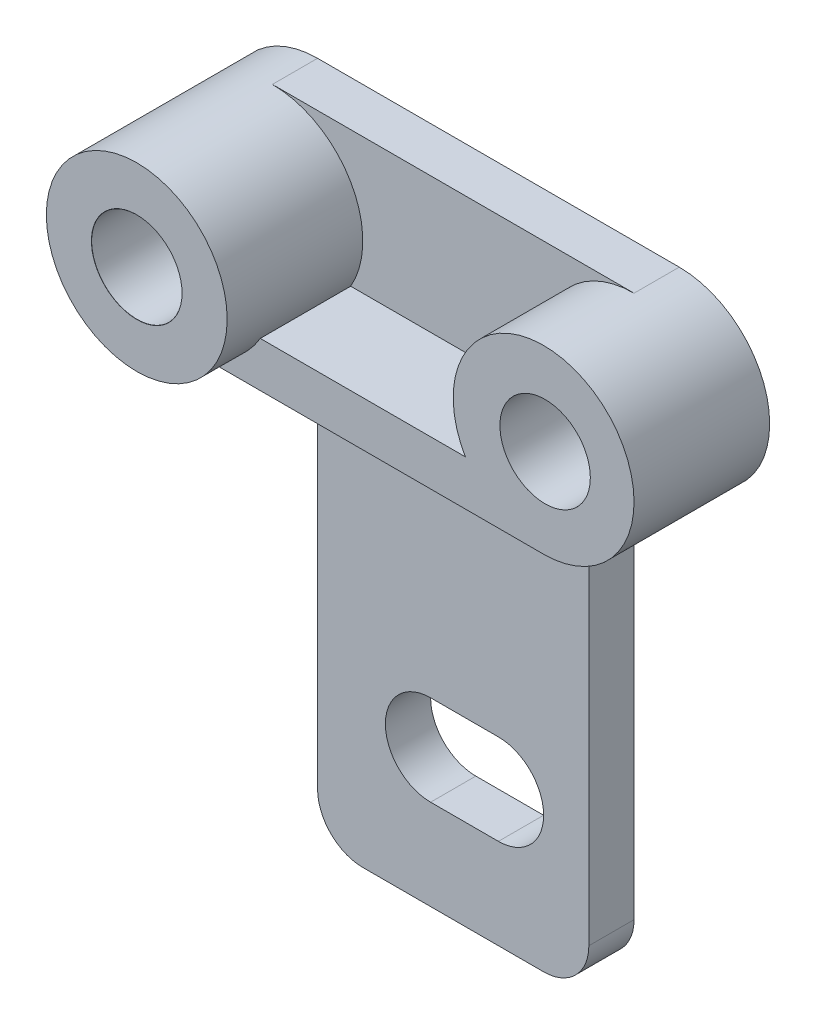
from build123d import *

# Parameters (mm, degrees)
SKETCH1_R                        = 20
BOSS_EXTRUDE1_DEPTH              = 40
SKETCH1_3_R                      = 20
BOSS_EXTRUDE2_DEPTH              = 30
SKETCH2_W                        = 80
SKETCH2_H                        = 40
BOSS_EXTRUDE3_DEPTH              = 10
SKETCH6_W                        = 80
SKETCH6_H                        = 10
BOSS_EXTRUDE4_DEPTH              = 30
F_20_0MM_DOWEL_HOLE1_D           = 20
F_20_0MM_DOWEL_HOLE1_CSINK_D     = 20.05
F_20_0MM_DOWEL_HOLE1_CSINK_ANGLE = 90
SKETCH11_W                       = 60
SKETCH11_H                       = 100
BOSS_EXTRUDE5_DEPTH              = 10
FILLET1_R                        = 10
FILLET2_R                        = 10
CUT_EXTRUDE2_REACH               = 139.477


with BuildPart() as part:
    # Sketch1 → Boss-Extrude1 (new body)
    with BuildSketch(Plane.XY):
        with Locations((-40, 0)):
            Circle(SKETCH1_R)
    extrude(amount=BOSS_EXTRUDE1_DEPTH)



with BuildPart() as body_2:
    # Sketch1<3> → Boss-Extrude2 (new body)
    with BuildSketch(Plane.XY):
        with Locations((40, 0)):
            Circle(SKETCH1_3_R)
    extrude(amount=BOSS_EXTRUDE2_DEPTH)


with BuildPart() as part_1:
    add(part.part)

    add(body_2.part)  # Boss-Extrude3 merges body 2
    # Sketch2 → Boss-Extrude3 (add)
    with BuildSketch(Plane(origin=(0, 0, 0), x_dir=(-1, 0, 0), z_dir=(0, 0, -1))):
        Rectangle(SKETCH2_W, SKETCH2_H)
    extrude(amount=-BOSS_EXTRUDE3_DEPTH)

    # Sketch6 → Boss-Extrude4 (add)
    with BuildSketch(Plane.XY.offset(30)):
        with Locations((0, -15)):
            Rectangle(SKETCH6_W, SKETCH6_H)
    extrude(amount=-BOSS_EXTRUDE4_DEPTH)

    # Ø20.0mm Dowel Hole1 (through all)
    with Locations(Plane.XY.offset(40)):
        with Locations((-40, 0), (40.331351324, -0.177410636)):
            CounterSinkHole(F_20_0MM_DOWEL_HOLE1_D / 2, F_20_0MM_DOWEL_HOLE1_CSINK_D / 2, counter_sink_angle=F_20_0MM_DOWEL_HOLE1_CSINK_ANGLE)

    # Sketch11 → Boss-Extrude5 (add)
    with BuildSketch(Plane(origin=(0, 0, 0), x_dir=(-1, 0, 0), z_dir=(0, 0, -1))):
        with Locations((0, -70)):
            Rectangle(SKETCH11_W, SKETCH11_H)
    extrude(amount=-BOSS_EXTRUDE5_DEPTH)

    # Fillet1
    fillet1_edges = [part_1.edges().sort_by_distance(p)[0] for p in [
        (-30, -120, 5),
    ]]
    fillet(fillet1_edges, radius=FILLET1_R)

    # Fillet2
    fillet2_edges = [part_1.edges().sort_by_distance(p)[0] for p in [
        (30, -120, 5),
    ]]
    fillet(fillet2_edges, radius=FILLET2_R)

    # Sketch12 → Cut-Extrude2 (cut, up to next)
    with BuildSketch(Plane.XY.offset(10), mode=Mode.PRIVATE) as cut_extrude2_sk1:
        with BuildLine():
            Line((-5, -80), (10, -80))
            ThreePointArc((10, -80), (20, -90), (10, -100))
            Line((10, -100), (-5, -100))
            ThreePointArc((-5, -100), (-15, -90), (-5, -80))
        make_face()
    cut_extrude2_tool1 = extrude(cut_extrude2_sk1.sketch, amount=-CUT_EXTRUDE2_REACH, mode=Mode.PRIVATE) & part_1.part
    add(cut_extrude2_tool1.solids().sort_by_distance((2.5, -90, 10))[0], mode=Mode.SUBTRACT)


solid = part_1.part
